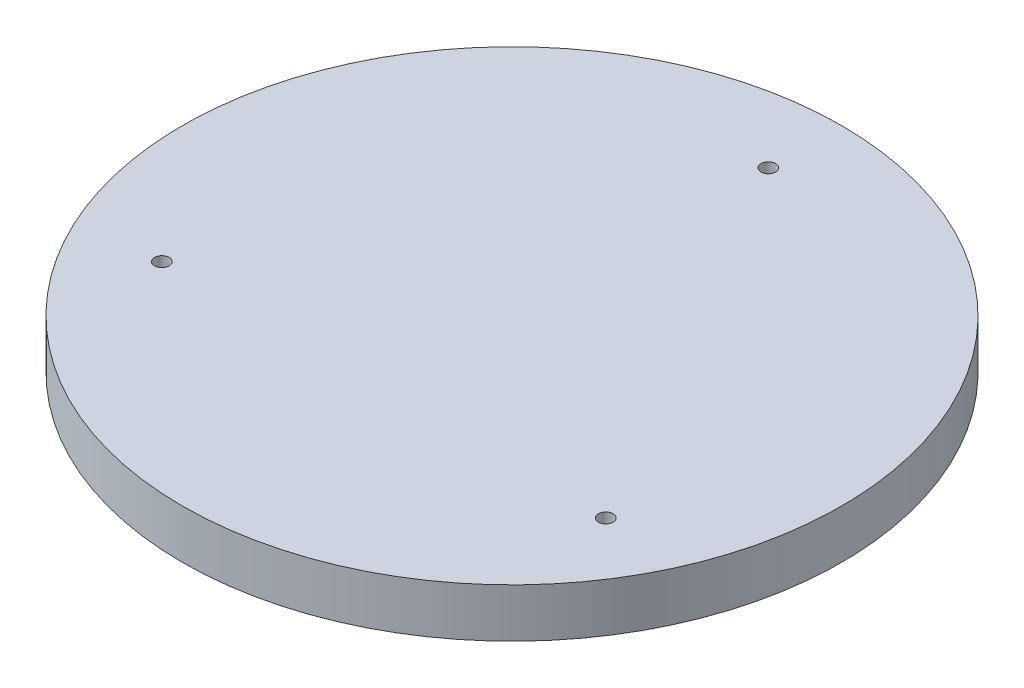
from build123d import *

# Parameters (mm, degrees)
SKETCH1_R           = 67.5
BOSS_EXTRUDE1_DEPTH = 10
SKETCH2_R           = 1.5
CUT_EXTRUDE1_DEPTH  = 96.981769102


with BuildPart() as part:
    # Sketch1 → Boss-Extrude1 (new body)
    with BuildSketch(Plane(origin=(0, 0, 0), x_dir=(1, 0, 0), z_dir=(0, 1, 0))):
        with Locations(Location((0, 0, 0), (0, 0, 270))):
            Circle(SKETCH1_R)
    extrude(amount=BOSS_EXTRUDE1_DEPTH)

    # Sketch2 → Cut-Extrude1 (cut, through all)
    with BuildSketch(Plane(origin=(0, 10, 0), x_dir=(1, 0, 0), z_dir=(0, 1, 0))):
        with Locations(Location((0, 52.5, 0), (0, 0, 270))):
            Circle(SKETCH2_R)
        with Locations(Location((45.466333699, -26.25, 0), (0, 0, 270))):
            Circle(SKETCH2_R)
        with Locations(Location((-45.466333699, -26.25, 0), (0, 0, 270))):
            Circle(SKETCH2_R)
    extrude(amount=-CUT_EXTRUDE1_DEPTH, mode=Mode.SUBTRACT)


solid = part.part
